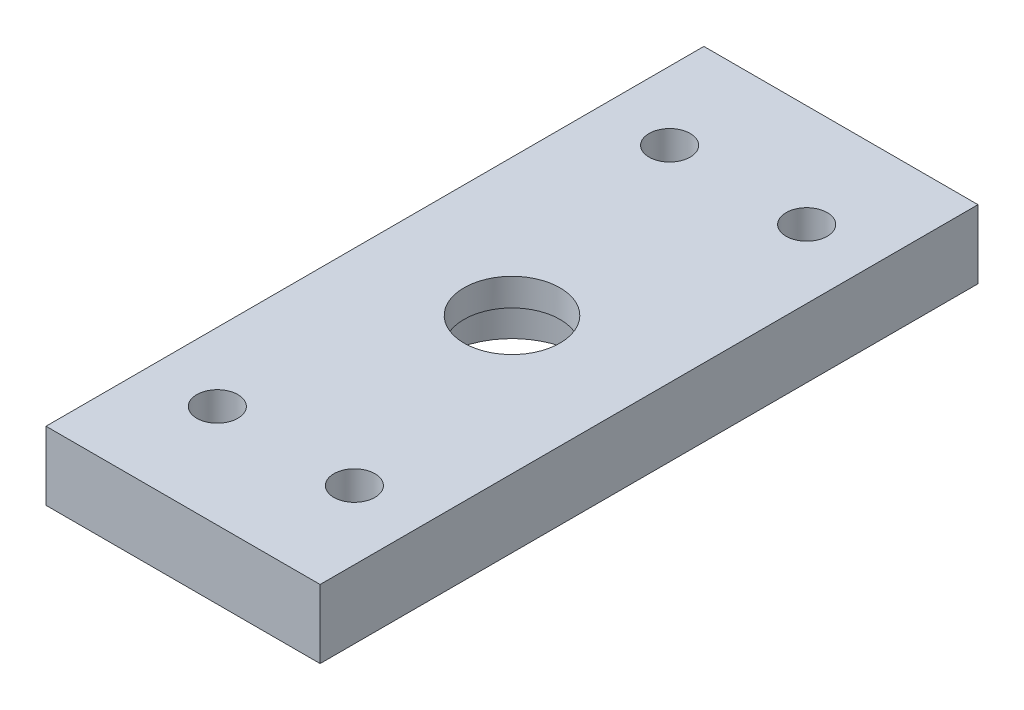
from build123d import *

# Parameters (mm, degrees)
SKETCH1_W           = 20
SKETCH1_H           = 48
BOSS_EXTRUDE1_DEPTH = 5
SKETCH2_R           = 3.5
CUT_EXTRUDE1_DEPTH  = 27.47640459
SKETCH3_R           = 5
CUT_EXTRUDE2_DEPTH  = 3
SKETCH4_R           = 1.5
CUT_EXTRUDE3_DEPTH  = 27.47640459


with BuildPart() as part:
    # Sketch1 → Boss-Extrude1 (new body)
    with BuildSketch(Plane(origin=(0, 0, 0), x_dir=(1, 0, 0), z_dir=(0, 1, 0))):
        Rectangle(SKETCH1_W, SKETCH1_H)
    extrude(amount=BOSS_EXTRUDE1_DEPTH)

    # Sketch2 → Cut-Extrude1 (cut, through all)
    with BuildSketch(Plane(origin=(0, 5, 0), x_dir=(1, 0, 0), z_dir=(0, 1, 0))):
        with Locations(Location((0, 0, 0), (0, 0, 270))):
            Circle(SKETCH2_R)
    extrude(amount=-CUT_EXTRUDE1_DEPTH, mode=Mode.SUBTRACT)

    # Sketch3 → Cut-Extrude2 (cut)
    with BuildSketch(Plane.XZ):
        with Locations(Location((0, 0, 0), (0, 0, 270))):
            Circle(SKETCH3_R)
    extrude(amount=-CUT_EXTRUDE2_DEPTH, mode=Mode.SUBTRACT)

    # Sketch4 → Cut-Extrude3 (cut, through all)
    with BuildSketch(Plane.XZ):
        with Locations(Location((5, -16.5, 0), (0, 0, 270))):
            Circle(SKETCH4_R)
        with Locations(Location((-5, -16.5, 0), (0, 0, 270))):
            Circle(SKETCH4_R)
        with Locations(Location((-5, 16.5, 0), (0, 0, 270))):
            Circle(SKETCH4_R)
        with Locations(Location((5, 16.5, 0), (0, 0, 270))):
            Circle(SKETCH4_R)
    extrude(amount=-CUT_EXTRUDE3_DEPTH, mode=Mode.SUBTRACT)


solid = part.part
